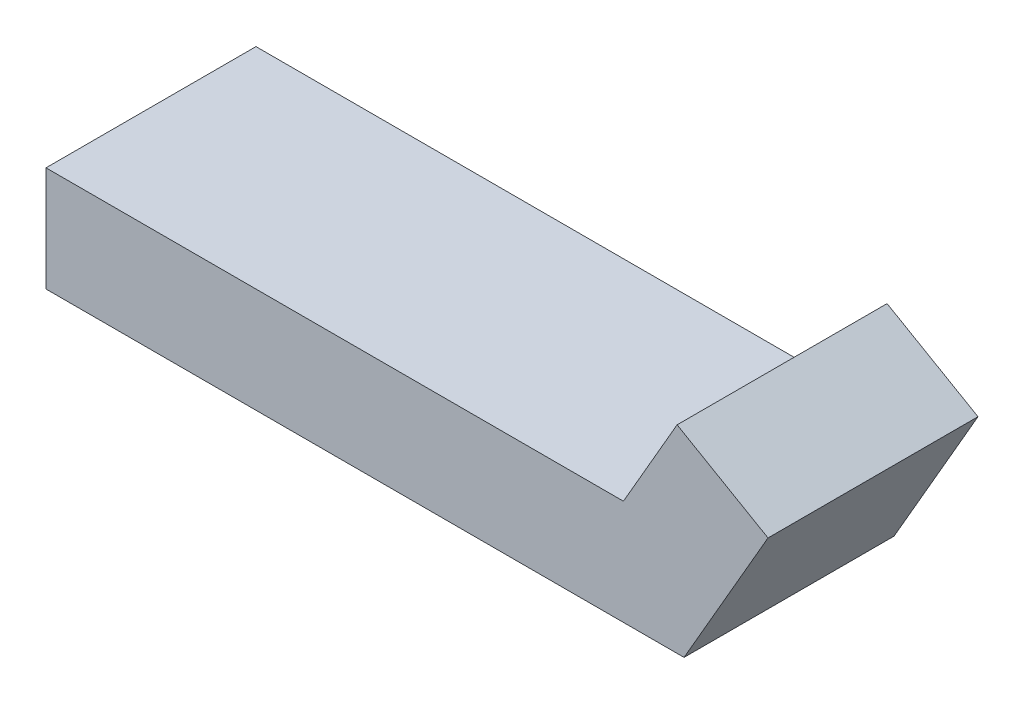
from build123d import *

# Parameters (mm, degrees)
BOSS_EXTRUDE1_DEPTH = 12.7


with BuildPart() as part:
    # Sketch1 → Boss-Extrude1 (new body)
    with BuildSketch(Plane.XY):
        Polygon((-21.744317078, 5.819081981), (13.180682922, 5.819081981), (16.427595817, 11.442900083), (21.926857132, 8.267900083), (16.846857132, -0.530918019), (-21.744317078, -0.530918019), align=None)
    extrude(amount=BOSS_EXTRUDE1_DEPTH)


solid = part.part
